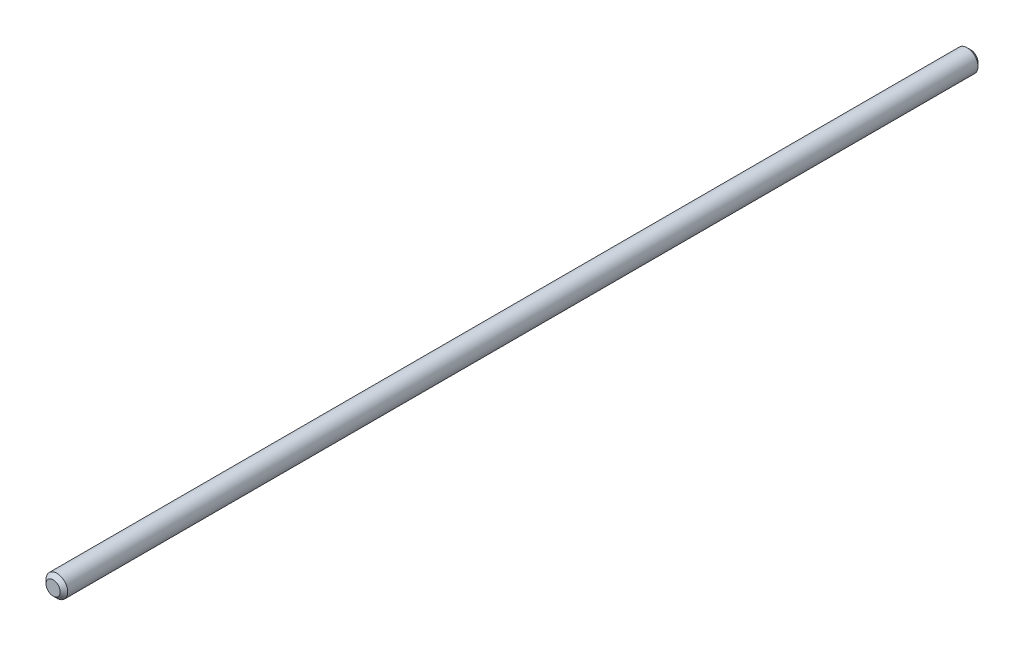
from build123d import *

# Parameters (mm, degrees)
SKETCH_1_R      = 2.9
EXTRUDE_1_DEPTH = 245
CHAMFER_1_SIZE  = 1


with BuildPart() as part:
    # Эскиз1 → Бобышка-Вытянуть1 (new body)
    with BuildSketch(Plane.XY):
        Circle(SKETCH_1_R)
    extrude(amount=EXTRUDE_1_DEPTH)

    # Фаска1
    chamfer_1_edges = [part.edges().sort_by_distance(p)[0] for p in [
        (-2.9, 0, 0),
        (-2.9, 0, 245),
    ]]
    chamfer(chamfer_1_edges, length=CHAMFER_1_SIZE)


solid = part.part
